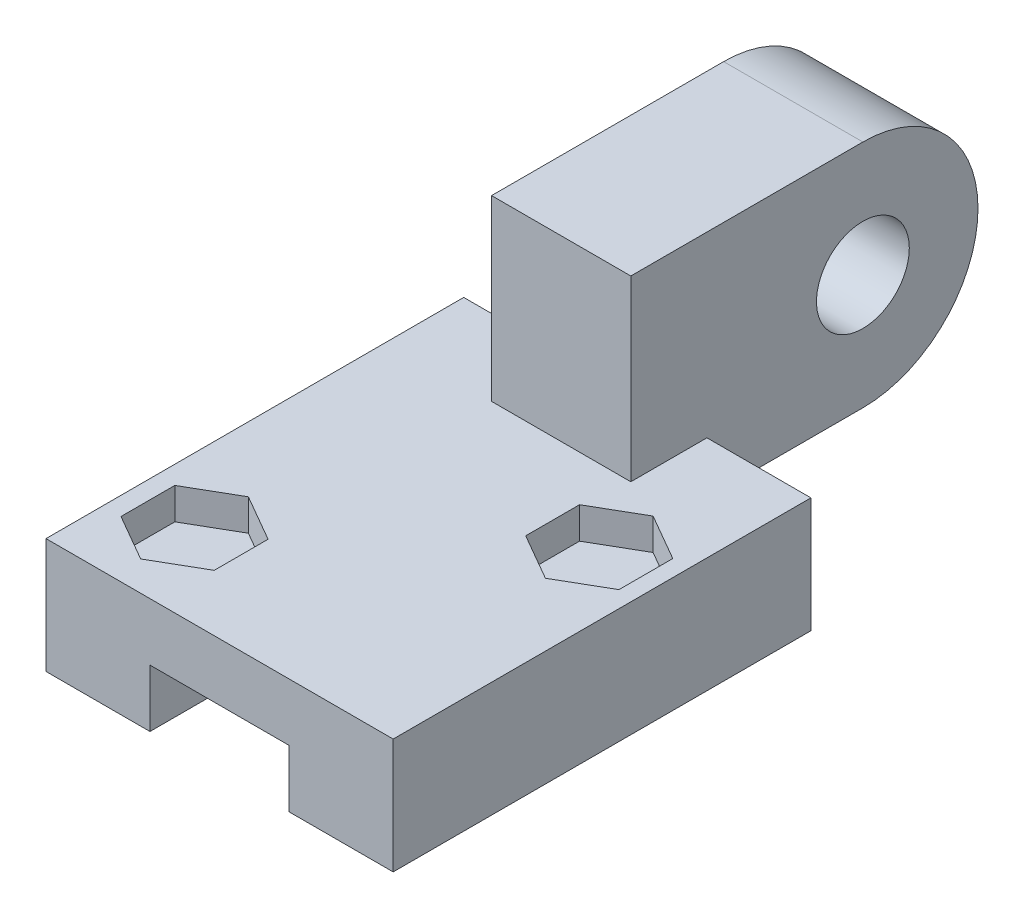
from build123d import *

# Parameters (mm, degrees)
SALIENTE_EXTRUIR1_DEPTH = 2.25
CROQUIS2_R              = 0.25
SALIENTE_EXTRUIR2_DEPTH = 0.375
CORTAR_EXTRUIR1_DEPTH   = 0.17


with BuildPart() as part:
    # Croquis1 → Saliente-Extruir1 (new body)
    with BuildSketch(Plane.XY):
        Polygon((-1.31, 0), (-1.87, 0), (-1.87, 0.62), (0, 0.62), (0, 0), (-0.56, 0), (-0.56, 0.31), (-1.31, 0.31), align=None)
    extrude(amount=SALIENTE_EXTRUIR1_DEPTH)

    # Croquis2 → Saliente-Extruir2 (add, symmetric)
    with BuildSketch(Plane(origin=(-0.935, 0, 0), x_dir=(0, 0, -1), z_dir=(1, 0, 0))):
        with BuildLine():
            Line((0.84, 1.58), (-0.41, 1.58))
            Line((-0.41, 1.58), (-0.41, 0.62))
            Line((-0.41, 0.62), (-0.41, 0.34))
            Line((-0.41, 0.34), (0.84, 0.34))
            ThreePointArc((0.84, 0.34), (1.46, 0.96), (0.84, 1.58))
        make_face()
        with Locations((0.84, 0.96)):
            Circle(CROQUIS2_R, mode=Mode.SUBTRACT)
    extrude(amount=SALIENTE_EXTRUIR2_DEPTH, both=True)

    # Croquis3 → Cortar-Extruir1 (cut)
    with BuildSketch(Plane(origin=(0, 0.62, 0), x_dir=(1, 0, 0), z_dir=(0, 1, 0))):
        Polygon((-0.088852633, -0.945), (-0.088852633, -0.655), (-0.34, -0.51), (-0.591147367, -0.655), (-0.591147367, -0.945), (-0.34, -1.09), align=None)
        Polygon((-1.268852633, -1.945), (-1.268852633, -1.655), (-1.52, -1.51), (-1.771147367, -1.655), (-1.771147367, -1.945), (-1.52, -2.09), align=None)
    extrude(amount=-CORTAR_EXTRUIR1_DEPTH, mode=Mode.SUBTRACT)


solid = part.part
